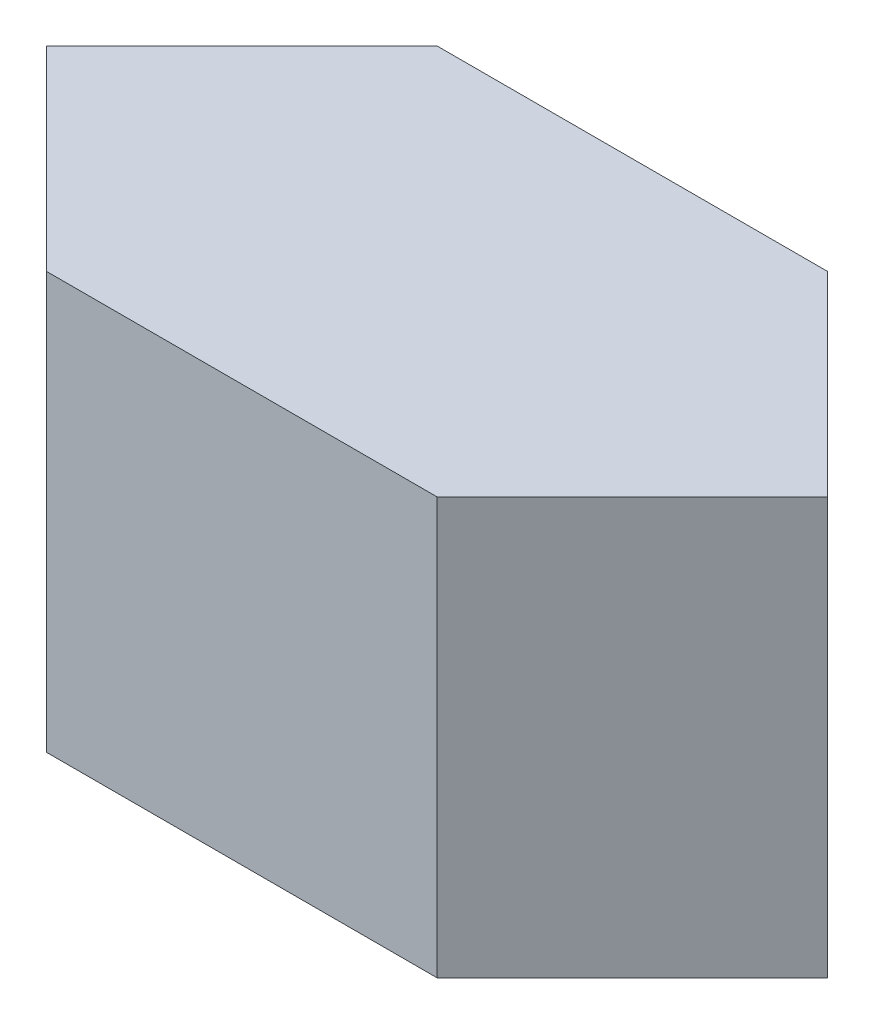
from build123d import *

# Parameters (mm, degrees)
SKETCH1_W           = 30
SKETCH1_H           = 30.000023288
BOSS_EXTRUDE2_DEPTH = 32


with BuildPart() as part:
    # Sketch1 → Boss-Extrude2 (new body)
    with BuildSketch(Plane(origin=(0, 0, 0), x_dir=(1, 0, 0), z_dir=(0, 1, 0))):
        Polygon((-15, 15.000011644), (-15, -15.000011644), (-30, -0.01868994), align=None)
        Rectangle(SKETCH1_W, SKETCH1_H)
        Polygon((30, -0.01868994), (15, -15.000011644), (15, 15.000011644), align=None)
    extrude(amount=BOSS_EXTRUDE2_DEPTH)


solid = part.part
